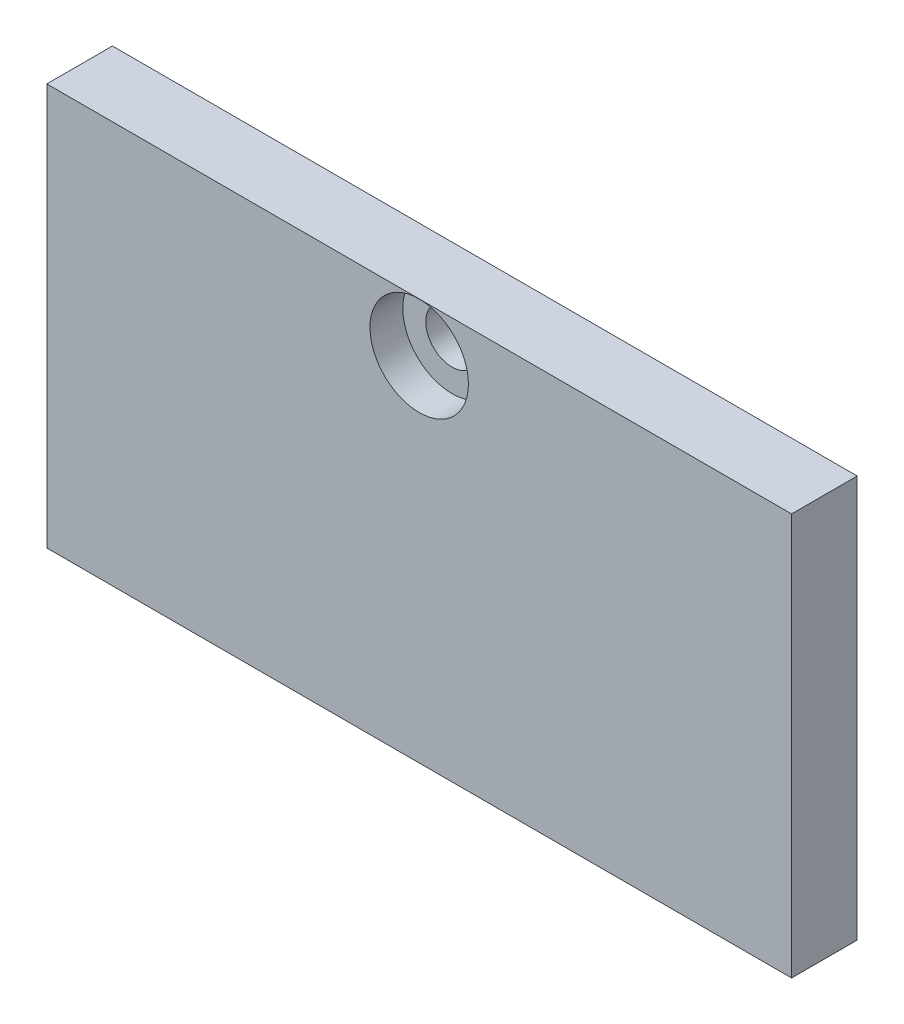
from build123d import *

# Parameters (mm, degrees)
SKETCH_1_W          = 45.4
SKETCH_1_H          = 24.5
EXTRUDE_1_DEPTH     = 4
SKETCH_2_R          = 1.6
CUT_EXTRUDE_1_DEPTH = 86.567076535
CUT_EXTRUDE_2_DEPTH = 2
SKETCH_4_W          = 12.5
SKETCH_4_H          = 36
CUT_EXTRUDE_3_DEPTH = 3.2
SKETCH_5_R          = 2.9
EXTRUDE_2_DEPTH     = 1.7


with BuildPart() as part:
    # 草图1 → 凸台-拉伸1 (new body)
    with BuildSketch(Plane.XY):
        with Locations((-53.753815265, 25.966995149)):
            Rectangle(SKETCH_1_W, SKETCH_1_H)
    extrude(amount=EXTRUDE_1_DEPTH)

    # 草图2 → 切除-拉伸1 (cut, through all)
    with BuildSketch(Plane.XY.offset(4)):
        with Locations((-53.753815265, 35.216995149)):
            Circle(SKETCH_2_R)
    extrude(amount=-CUT_EXTRUDE_1_DEPTH, mode=Mode.SUBTRACT)

    # 草图3 → 切除-拉伸2 (cut)
    with BuildSketch(Plane.XY.offset(4)):
        with BuildLine():
            Line((-54.063374879, 38.200981215), (-53.486501698, 38.205061992))
            ThreePointArc((-53.486501698, 38.205061992), (-53.732593924, 32.217070207), (-54.063374879, 38.200981215))
        make_face()
    extrude(amount=-CUT_EXTRUDE_2_DEPTH, mode=Mode.SUBTRACT)

    # 草图4 → 切除-拉伸3 (cut)
    with BuildSketch(Plane(origin=(0, 0, 0), x_dir=(-1, 0, 0), z_dir=(0, 0, -1))):
        with Locations((53.753815265, 13.716995149)):
            Rectangle(SKETCH_4_W, SKETCH_4_H)
    extrude(amount=-CUT_EXTRUDE_3_DEPTH, mode=Mode.SUBTRACT)

    # 草图5 → 凸台-拉伸2 (add)
    with BuildSketch(Plane(origin=(0, 0, 0), x_dir=(-1, 0, 0), z_dir=(0, 0, -1))):
        with Locations(Location((44.469048356, 31.503088385, 0), (0, 0, 180))):
            Circle(SKETCH_5_R)
        with Locations(Location((63.038582174, 31.503088385, 0), (0, 0, 180))):
            Circle(SKETCH_5_R)
    extrude(amount=EXTRUDE_2_DEPTH)


solid = part.part
